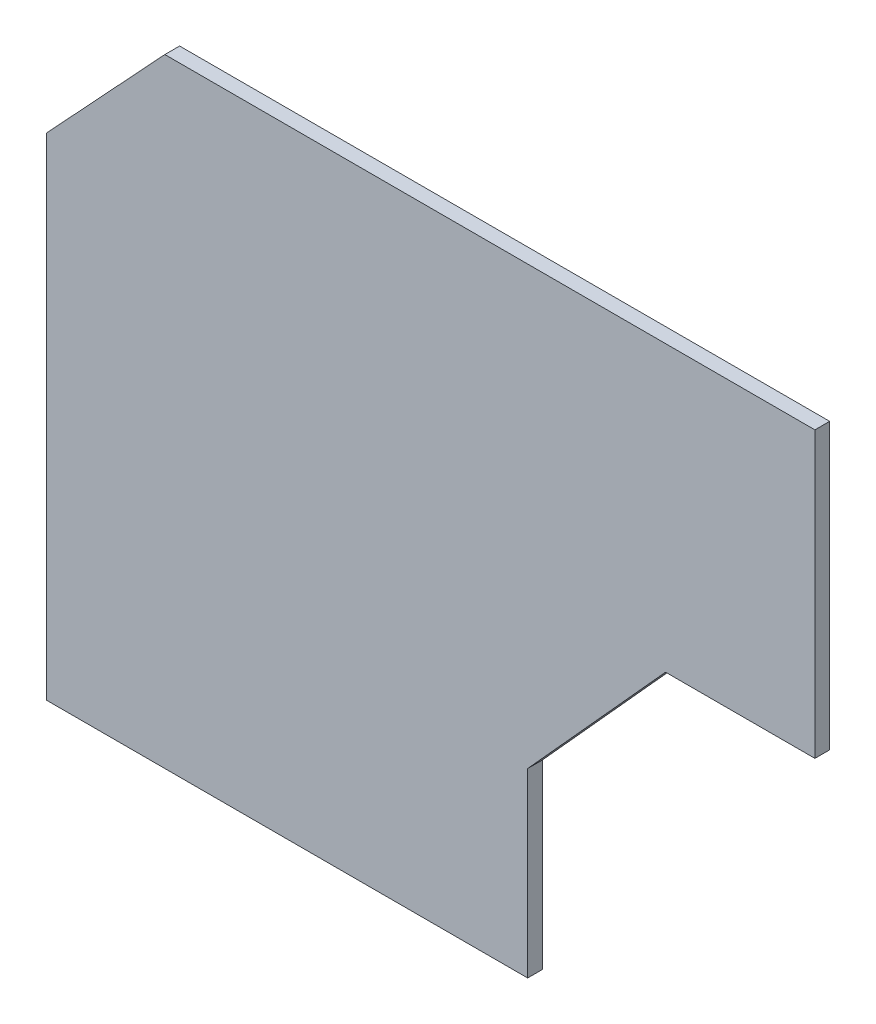
from build123d import *

# Parameters (mm, degrees)
SALIENTE_EXTRUIR1_DEPTH = 2


with BuildPart() as part:
    # Croquis1 → Saliente-Extruir1 (new body)
    with BuildSketch(Plane.XY):
        Polygon((-104.012014783, -17.228371386), (-87.972500451, 0), (0, 0), (0, -38.505278153), (-20.213735825, -38.505278153), (-38.871946374, -59.127510865), (-38.871946374, -83.677787904), (-104.012014783, -83.677787904), align=None)
    extrude(amount=SALIENTE_EXTRUIR1_DEPTH)


solid = part.part
